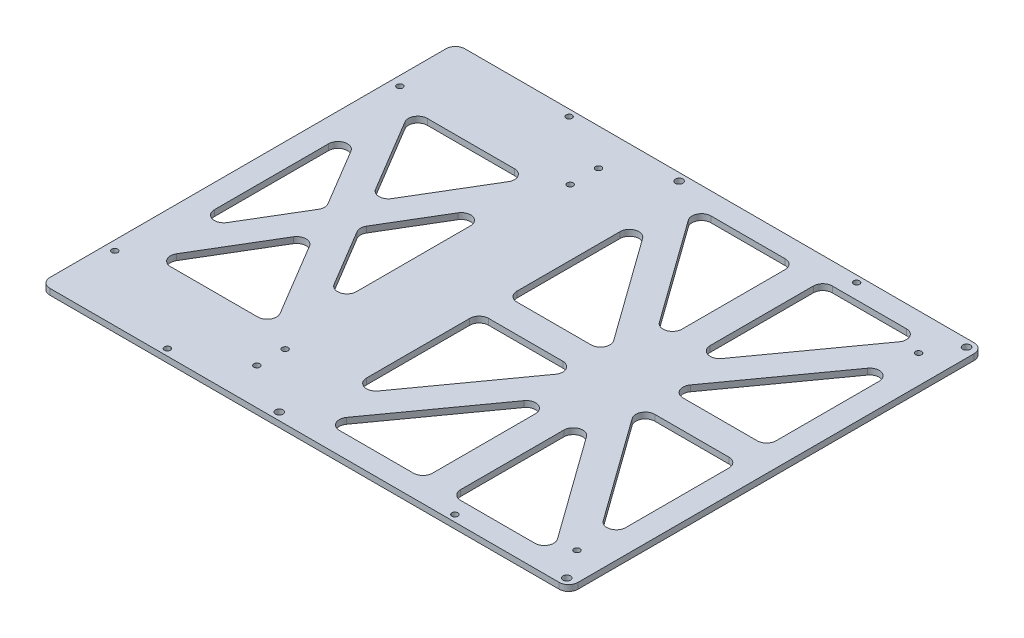
from build123d import *

# Parameters (mm, degrees)
SKETCH1_R                  = 3.175
BODY_DEPTH                 = 6.35
ELECTRONICS_BOX_REACH      = 358.146
SKETCH3_R                  = 4
BATTERY_CHARGER_REACH      = 358.146
SKETCH5_R                  = 3.175
FILLETS_REACH              = 358.146
PLANT_MOUNTING_HOLES_REACH = 358.146
SKETCH7_R                  = 3.175


with BuildPart() as part:
    # Sketch1 → Body (new body)
    with BuildSketch(Plane(origin=(0, 0, 0), x_dir=(1, 0, 0), z_dir=(0, 1, 0))):
        with BuildLine():
            Line((-280, -210), (-280, 210))
            ThreePointArc((-280, 210), (-277.071067812, 217.071067812), (-270, 220))
            Line((-270, 220), (270, 220))
            ThreePointArc((270, 220), (277.071067812, 217.071067812), (280, 210))
            Line((280, 210), (280, -210))
            ThreePointArc((280, -210), (277.071067812, -217.071067812), (270, -220))
            Line((270, -220), (-270, -220))
            ThreePointArc((-270, -220), (-277.071067812, -217.071067812), (-280, -210))
        make_face()
        with Locations(Location((-152.4, -213, 0), (0, 0, 270))):
            Circle(SKETCH1_R, mode=Mode.SUBTRACT)
        with Locations(Location((-152.4, 213, 0), (0, 0, 90))):
            Circle(SKETCH1_R, mode=Mode.SUBTRACT)
        with Locations(Location((152.4, 213, 0), (0, 0, 270))):
            Circle(SKETCH1_R, mode=Mode.SUBTRACT)
        with Locations(Location((152.4, -213, 0), (0, 0, 90))):
            Circle(SKETCH1_R, mode=Mode.SUBTRACT)
    extrude(amount=BODY_DEPTH)

    # Sketch3 → Electronics Box (cut, up to next)
    with BuildSketch(Plane(origin=(0, 6.35, 0), x_dir=(1, 0, 0), z_dir=(0, 1, 0)), mode=Mode.PRIVATE) as electronics_box_sk1:
        with Locations(Location((-34.8, -211.98, 0), (0, 0, 270))):
            Circle(SKETCH3_R)
    electronics_box_tool1 = extrude(electronics_box_sk1.sketch, amount=-ELECTRONICS_BOX_REACH, mode=Mode.PRIVATE) & part.part
    # Sketch3 → Electronics Box (cut, up to next)
    with BuildSketch(Plane(origin=(0, 6.35, 0), x_dir=(1, 0, 0), z_dir=(0, 1, 0)), mode=Mode.PRIVATE) as electronics_box_sk2:
        with Locations(Location((270, -211.98, 0), (0, 0, 270))):
            Circle(SKETCH3_R)
    electronics_box_tool2 = extrude(electronics_box_sk2.sketch, amount=-ELECTRONICS_BOX_REACH, mode=Mode.PRIVATE) & part.part
    # Sketch3 → Electronics Box (cut, up to next)
    with BuildSketch(Plane(origin=(0, 6.35, 0), x_dir=(1, 0, 0), z_dir=(0, 1, 0)), mode=Mode.PRIVATE) as electronics_box_sk3:
        with Locations(Location((270, 211.98, 0), (0, 0, 270))):
            Circle(SKETCH3_R)
    electronics_box_tool3 = extrude(electronics_box_sk3.sketch, amount=-ELECTRONICS_BOX_REACH, mode=Mode.PRIVATE) & part.part
    # Sketch3 → Electronics Box (cut, up to next)
    with BuildSketch(Plane(origin=(0, 6.35, 0), x_dir=(1, 0, 0), z_dir=(0, 1, 0)), mode=Mode.PRIVATE) as electronics_box_sk4:
        with Locations(Location((-34.8, 211.98, 0), (0, 0, 270))):
            Circle(SKETCH3_R)
    electronics_box_tool4 = extrude(electronics_box_sk4.sketch, amount=-ELECTRONICS_BOX_REACH, mode=Mode.PRIVATE) & part.part
    add(electronics_box_tool1.solids().sort_by_distance((-34.8, 6.35, 211.98))[0], mode=Mode.SUBTRACT)
    add(electronics_box_tool2.solids().sort_by_distance((270, 6.35, 211.98))[0], mode=Mode.SUBTRACT)
    add(electronics_box_tool3.solids().sort_by_distance((270, 6.35, -211.98))[0], mode=Mode.SUBTRACT)
    add(electronics_box_tool4.solids().sort_by_distance((-34.8, 6.35, -211.98))[0], mode=Mode.SUBTRACT)

    # Sketch5 → Battery Charger (cut, up to next)
    with BuildSketch(Plane(origin=(0, 6.35, 0), x_dir=(1, 0, 0), z_dir=(0, 1, 0)), mode=Mode.PRIVATE) as battery_charger_sk1:
        with Locations(Location((-270, -151.13, 0), (0, 0, 270))):
            Circle(SKETCH5_R)
    battery_charger_tool1 = extrude(battery_charger_sk1.sketch, amount=-BATTERY_CHARGER_REACH, mode=Mode.PRIVATE) & part.part
    # Sketch5 → Battery Charger (cut, up to next)
    with BuildSketch(Plane(origin=(0, 6.35, 0), x_dir=(1, 0, 0), z_dir=(0, 1, 0)), mode=Mode.PRIVATE) as battery_charger_sk2:
        with Locations(Location((-270, 151.13, 0), (0, 0, 270))):
            Circle(SKETCH5_R)
    battery_charger_tool2 = extrude(battery_charger_sk2.sketch, amount=-BATTERY_CHARGER_REACH, mode=Mode.PRIVATE) & part.part
    # Sketch5 → Battery Charger (cut, up to next)
    with BuildSketch(Plane(origin=(0, 6.35, 0), x_dir=(1, 0, 0), z_dir=(0, 1, 0)), mode=Mode.PRIVATE) as battery_charger_sk3:
        with Locations(Location((-89.43, -151.13, 0), (0, 0, 270))):
            Circle(SKETCH5_R)
    battery_charger_tool3 = extrude(battery_charger_sk3.sketch, amount=-BATTERY_CHARGER_REACH, mode=Mode.PRIVATE) & part.part
    # Sketch5 → Battery Charger (cut, up to next)
    with BuildSketch(Plane(origin=(0, 6.35, 0), x_dir=(1, 0, 0), z_dir=(0, 1, 0)), mode=Mode.PRIVATE) as battery_charger_sk4:
        with Locations(Location((-89.43, 151.13, 0), (0, 0, 270))):
            Circle(SKETCH5_R)
    battery_charger_tool4 = extrude(battery_charger_sk4.sketch, amount=-BATTERY_CHARGER_REACH, mode=Mode.PRIVATE) & part.part
    add(battery_charger_tool1.solids().sort_by_distance((-270, 6.35, 151.13))[0], mode=Mode.SUBTRACT)
    add(battery_charger_tool2.solids().sort_by_distance((-270, 6.35, -151.13))[0], mode=Mode.SUBTRACT)
    add(battery_charger_tool3.solids().sort_by_distance((-89.43, 6.35, 151.13))[0], mode=Mode.SUBTRACT)
    add(battery_charger_tool4.solids().sort_by_distance((-89.43, 6.35, -151.13))[0], mode=Mode.SUBTRACT)

    # Sketch6 → Fillets (cut, up to next)
    with BuildSketch(Plane(origin=(0, 6.35, 0), x_dir=(1, 0, 0), z_dir=(0, 1, 0)), mode=Mode.PRIVATE) as fillets_sk1:
        with BuildLine():
            Line((-255, 60.535084541), (-255, -60.535084541))
            ThreePointArc((-255, -60.535084541), (-247.660110592, -70.17478431), (-236.415237673, -65.663618033))
            Line((-236.415237673, -65.663618033), (-200.251603002, -5.128533492))
            ThreePointArc((-200.251603002, -5.128533492), (-198.836365329, 0), (-200.251603002, 5.128533492))
            Line((-200.251603002, 5.128533492), (-236.415237673, 65.663618033))
            ThreePointArc((-236.415237673, 65.663618033), (-247.660110592, 70.17478431), (-255, 60.535084541))
        make_face()
    fillets_tool1 = extrude(fillets_sk1.sketch, amount=-FILLETS_REACH, mode=Mode.PRIVATE) & part.part
    # Sketch6 → Fillets (cut, up to next)
    with BuildSketch(Plane(origin=(0, 6.35, 0), x_dir=(1, 0, 0), z_dir=(0, 1, 0)), mode=Mode.PRIVATE) as fillets_sk2:
        with BuildLine():
            Line((-159.178396998, 5.128533492), (-123.014762327, 65.663618033))
            ThreePointArc((-123.014762327, 65.663618033), (-111.769889408, 70.17478431), (-104.43, 60.535084541))
            Line((-104.43, 60.535084541), (-104.43, -60.535084541))
            ThreePointArc((-104.43, -60.535084541), (-111.769889408, -70.17478431), (-123.014762327, -65.663618033))
            Line((-123.014762327, -65.663618033), (-159.178396998, -5.128533492))
            ThreePointArc((-159.178396998, -5.128533492), (-160.593634671, 0), (-159.178396998, 5.128533492))
        make_face()
    fillets_tool2 = extrude(fillets_sk2.sketch, amount=-FILLETS_REACH, mode=Mode.PRIVATE) & part.part
    # Sketch6 → Fillets (cut, up to next)
    with BuildSketch(Plane(origin=(0, 6.35, 0), x_dir=(1, 0, 0), z_dir=(0, 1, 0)), mode=Mode.PRIVATE) as fillets_sk3:
        with BuildLine():
            Line((-234.528407254, -121.001466508), (-188.299762327, -43.618345194))
            ThreePointArc((-188.299762327, -43.618345194), (-179.715, -38.746878687), (-171.130237673, -43.618345194))
            Line((-171.130237673, -43.618345194), (-124.901592746, -121.001466508))
            ThreePointArc((-124.901592746, -121.001466508), (-124.78907576, -131.065314837), (-133.486355073, -136.13))
            Line((-133.486355073, -136.13), (-225.943644927, -136.13))
            ThreePointArc((-225.943644927, -136.13), (-234.64092424, -131.065314837), (-234.528407254, -121.001466508))
        make_face()
    fillets_tool3 = extrude(fillets_sk3.sketch, amount=-FILLETS_REACH, mode=Mode.PRIVATE) & part.part
    # Sketch6 → Fillets (cut, up to next)
    with BuildSketch(Plane(origin=(0, 6.35, 0), x_dir=(1, 0, 0), z_dir=(0, 1, 0)), mode=Mode.PRIVATE) as fillets_sk4:
        with BuildLine():
            Line((-171.130237673, 43.618345194), (-124.901592746, 121.001466508))
            ThreePointArc((-124.901592746, 121.001466508), (-124.78907576, 131.065314837), (-133.486355073, 136.13))
            Line((-133.486355073, 136.13), (-225.943644927, 136.13))
            ThreePointArc((-225.943644927, 136.13), (-234.64092424, 131.065314837), (-234.528407254, 121.001466508))
            Line((-234.528407254, 121.001466508), (-188.299762327, 43.618345194))
            ThreePointArc((-188.299762327, 43.618345194), (-179.715, 38.746878687), (-171.130237673, 43.618345194))
        make_face()
    fillets_tool4 = extrude(fillets_sk4.sketch, amount=-FILLETS_REACH, mode=Mode.PRIVATE) & part.part
    # Sketch6 → Fillets (cut, up to next)
    with BuildSketch(Plane(origin=(0, 6.35, 0), x_dir=(1, 0, 0), z_dir=(0, 1, 0)), mode=Mode.PRIVATE) as fillets_sk5:
        with BuildLine():
            Line((-1.680561104, 140.21611569), (76.955740185, 30.837354881))
            ThreePointArc((76.955740185, 30.837354881), (77.734996384, 20.437848578), (68.836301289, 15))
            Line((68.836301289, 15), (-9.8, 15))
            ThreePointArc((-9.8, 15), (-16.871067812, 17.928932188), (-19.8, 25))
            Line((-19.8, 25), (-19.8, 134.378760808))
            ThreePointArc((-19.8, 134.378760808), (-12.866399439, 143.897016661), (-1.680561104, 140.21611569))
        make_face()
    fillets_tool5 = extrude(fillets_sk5.sketch, amount=-FILLETS_REACH, mode=Mode.PRIVATE) & part.part
    # Sketch6 → Fillets (cut, up to next)
    with BuildSketch(Plane(origin=(0, 6.35, 0), x_dir=(1, 0, 0), z_dir=(0, 1, 0)), mode=Mode.PRIVATE) as fillets_sk6:
        with BuildLine():
            Line((255, 25), (255, 134.378760808))
            ThreePointArc((255, 134.378760808), (248.066399439, 143.897016661), (236.880561104, 140.21611569))
            Line((236.880561104, 140.21611569), (158.244259815, 30.837354881))
            ThreePointArc((158.244259815, 30.837354881), (157.465003616, 20.437848578), (166.363698711, 15))
            Line((166.363698711, 15), (245, 15))
            ThreePointArc((245, 15), (252.071067812, 17.928932188), (255, 25))
        make_face()
    fillets_tool6 = extrude(fillets_sk6.sketch, amount=-FILLETS_REACH, mode=Mode.PRIVATE) & part.part
    # Sketch6 → Fillets (cut, up to next)
    with BuildSketch(Plane(origin=(0, 6.35, 0), x_dir=(1, 0, 0), z_dir=(0, 1, 0)), mode=Mode.PRIVATE) as fillets_sk7:
        with BuildLine():
            Line((84.480561104, 71.76388431), (5.844259815, 181.142645119))
            ThreePointArc((5.844259815, 181.142645119), (5.065003616, 191.542151422), (13.963698711, 196.98))
            Line((13.963698711, 196.98), (92.6, 196.98))
            ThreePointArc((92.6, 196.98), (99.671067812, 194.051067812), (102.6, 186.98))
            Line((102.6, 186.98), (102.6, 77.601239192))
            ThreePointArc((102.6, 77.601239192), (95.666399439, 68.082983339), (84.480561104, 71.76388431))
        make_face()
    fillets_tool7 = extrude(fillets_sk7.sketch, amount=-FILLETS_REACH, mode=Mode.PRIVATE) & part.part
    # Sketch6 → Fillets (cut, up to next)
    with BuildSketch(Plane(origin=(0, 6.35, 0), x_dir=(1, 0, 0), z_dir=(0, 1, 0)), mode=Mode.PRIVATE) as fillets_sk8:
        with BuildLine():
            Line((221.236301289, 196.98), (142.6, 196.98))
            ThreePointArc((142.6, 196.98), (135.528932188, 194.051067812), (132.6, 186.98))
            Line((132.6, 186.98), (132.6, 77.601239192))
            ThreePointArc((132.6, 77.601239192), (139.533600561, 68.082983339), (150.719438896, 71.76388431))
            Line((150.719438896, 71.76388431), (229.355740185, 181.142645119))
            ThreePointArc((229.355740185, 181.142645119), (230.134996384, 191.542151422), (221.236301289, 196.98))
        make_face()
    fillets_tool8 = extrude(fillets_sk8.sketch, amount=-FILLETS_REACH, mode=Mode.PRIVATE) & part.part
    # Sketch6 → Fillets (cut, up to next)
    with BuildSketch(Plane(origin=(0, 6.35, 0), x_dir=(1, 0, 0), z_dir=(0, 1, 0)), mode=Mode.PRIVATE) as fillets_sk9:
        with BuildLine():
            Line((102.6, -77.601239192), (102.6, -186.98))
            ThreePointArc((102.6, -186.98), (99.671067812, -194.051067812), (92.6, -196.98))
            Line((92.6, -196.98), (13.963698711, -196.98))
            ThreePointArc((13.963698711, -196.98), (5.065003616, -191.542151422), (5.844259815, -181.142645119))
            Line((5.844259815, -181.142645119), (84.480561104, -71.76388431))
            ThreePointArc((84.480561104, -71.76388431), (95.666399439, -68.082983339), (102.6, -77.601239192))
        make_face()
    fillets_tool9 = extrude(fillets_sk9.sketch, amount=-FILLETS_REACH, mode=Mode.PRIVATE) & part.part
    # Sketch6 → Fillets (cut, up to next)
    with BuildSketch(Plane(origin=(0, 6.35, 0), x_dir=(1, 0, 0), z_dir=(0, 1, 0)), mode=Mode.PRIVATE) as fillets_sk10:
        with BuildLine():
            Line((150.719438896, -71.76388431), (229.355740185, -181.142645119))
            ThreePointArc((229.355740185, -181.142645119), (230.134996384, -191.542151422), (221.236301289, -196.98))
            Line((221.236301289, -196.98), (142.6, -196.98))
            ThreePointArc((142.6, -196.98), (135.528932188, -194.051067812), (132.6, -186.98))
            Line((132.6, -186.98), (132.6, -77.601239192))
            ThreePointArc((132.6, -77.601239192), (139.533600561, -68.082983339), (150.719438896, -71.76388431))
        make_face()
    fillets_tool10 = extrude(fillets_sk10.sketch, amount=-FILLETS_REACH, mode=Mode.PRIVATE) & part.part
    # Sketch6 → Fillets (cut, up to next)
    with BuildSketch(Plane(origin=(0, 6.35, 0), x_dir=(1, 0, 0), z_dir=(0, 1, 0)), mode=Mode.PRIVATE) as fillets_sk11:
        with BuildLine():
            Line((236.880561104, -140.21611569), (158.244259815, -30.837354881))
            ThreePointArc((158.244259815, -30.837354881), (157.465003616, -20.437848578), (166.363698711, -15))
            Line((166.363698711, -15), (245, -15))
            ThreePointArc((245, -15), (252.071067812, -17.928932188), (255, -25))
            Line((255, -25), (255, -134.378760808))
            ThreePointArc((255, -134.378760808), (248.066399439, -143.897016661), (236.880561104, -140.21611569))
        make_face()
    fillets_tool11 = extrude(fillets_sk11.sketch, amount=-FILLETS_REACH, mode=Mode.PRIVATE) & part.part
    # Sketch6 → Fillets (cut, up to next)
    with BuildSketch(Plane(origin=(0, 6.35, 0), x_dir=(1, 0, 0), z_dir=(0, 1, 0)), mode=Mode.PRIVATE) as fillets_sk12:
        with BuildLine():
            Line((-19.8, -25), (-19.8, -134.378760808))
            ThreePointArc((-19.8, -134.378760808), (-12.866399439, -143.897016661), (-1.680561104, -140.21611569))
            Line((-1.680561104, -140.21611569), (76.955740185, -30.837354881))
            ThreePointArc((76.955740185, -30.837354881), (77.734996384, -20.437848578), (68.836301289, -15))
            Line((68.836301289, -15), (-9.8, -15))
            ThreePointArc((-9.8, -15), (-16.871067812, -17.928932188), (-19.8, -25))
        make_face()
    fillets_tool12 = extrude(fillets_sk12.sketch, amount=-FILLETS_REACH, mode=Mode.PRIVATE) & part.part
    add(fillets_tool1.solids().sort_by_distance((-234.493731, 6.35, 0))[0], mode=Mode.SUBTRACT)
    add(fillets_tool2.solids().sort_by_distance((-124.936269, 6.35, 0))[0], mode=Mode.SUBTRACT)
    add(fillets_tool3.solids().sort_by_distance((-179.715, 6.35, 100.443358))[0], mode=Mode.SUBTRACT)
    add(fillets_tool4.solids().sort_by_distance((-179.715, 6.35, -100.443358))[0], mode=Mode.SUBTRACT)
    add(fillets_tool5.solids().sort_by_distance((16.371701, 6.35, -63.773404))[0], mode=Mode.SUBTRACT)
    add(fillets_tool6.solids().sort_by_distance((218.828299, 6.35, -63.773404))[0], mode=Mode.SUBTRACT)
    add(fillets_tool7.solids().sort_by_distance((66.428299, 6.35, -148.206596))[0], mode=Mode.SUBTRACT)
    add(fillets_tool8.solids().sort_by_distance((168.771701, 6.35, -148.206596))[0], mode=Mode.SUBTRACT)
    add(fillets_tool9.solids().sort_by_distance((66.428299, 6.35, 148.206596))[0], mode=Mode.SUBTRACT)
    add(fillets_tool10.solids().sort_by_distance((168.771701, 6.35, 148.206596))[0], mode=Mode.SUBTRACT)
    add(fillets_tool11.solids().sort_by_distance((218.828299, 6.35, 63.773404))[0], mode=Mode.SUBTRACT)
    add(fillets_tool12.solids().sort_by_distance((16.371701, 6.35, 63.773404))[0], mode=Mode.SUBTRACT)

    # Sketch7 → Plant Mounting holes (cut, up to next)
    with BuildSketch(Plane(origin=(0, 6.35, 0), x_dir=(1, 0, 0), z_dir=(0, 1, 0)), mode=Mode.PRIVATE) as plant_mounting_holes_sk1:
        with Locations(Location((250, 181.13, 0), (0, 0, 270))):
            Circle(SKETCH7_R)
    plant_mounting_holes_tool1 = extrude(plant_mounting_holes_sk1.sketch, amount=-PLANT_MOUNTING_HOLES_REACH, mode=Mode.PRIVATE) & part.part
    # Sketch7 → Plant Mounting holes (cut, up to next)
    with BuildSketch(Plane(origin=(0, 6.35, 0), x_dir=(1, 0, 0), z_dir=(0, 1, 0)), mode=Mode.PRIVATE) as plant_mounting_holes_sk2:
        with Locations(Location((-89.43, 181.13, 0), (0, 0, 270))):
            Circle(SKETCH7_R)
    plant_mounting_holes_tool2 = extrude(plant_mounting_holes_sk2.sketch, amount=-PLANT_MOUNTING_HOLES_REACH, mode=Mode.PRIVATE) & part.part
    # Sketch7 → Plant Mounting holes (cut, up to next)
    with BuildSketch(Plane(origin=(0, 6.35, 0), x_dir=(1, 0, 0), z_dir=(0, 1, 0)), mode=Mode.PRIVATE) as plant_mounting_holes_sk3:
        with Locations(Location((-89.43, -181.13, 0), (0, 0, 90))):
            Circle(SKETCH7_R)
    plant_mounting_holes_tool3 = extrude(plant_mounting_holes_sk3.sketch, amount=-PLANT_MOUNTING_HOLES_REACH, mode=Mode.PRIVATE) & part.part
    # Sketch7 → Plant Mounting holes (cut, up to next)
    with BuildSketch(Plane(origin=(0, 6.35, 0), x_dir=(1, 0, 0), z_dir=(0, 1, 0)), mode=Mode.PRIVATE) as plant_mounting_holes_sk4:
        with Locations(Location((250, -181.13, 0), (0, 0, 90))):
            Circle(SKETCH7_R)
    plant_mounting_holes_tool4 = extrude(plant_mounting_holes_sk4.sketch, amount=-PLANT_MOUNTING_HOLES_REACH, mode=Mode.PRIVATE) & part.part
    add(plant_mounting_holes_tool1.solids().sort_by_distance((250, 6.35, -181.13))[0], mode=Mode.SUBTRACT)
    add(plant_mounting_holes_tool2.solids().sort_by_distance((-89.43, 6.35, -181.13))[0], mode=Mode.SUBTRACT)
    add(plant_mounting_holes_tool3.solids().sort_by_distance((-89.43, 6.35, 181.13))[0], mode=Mode.SUBTRACT)
    add(plant_mounting_holes_tool4.solids().sort_by_distance((250, 6.35, 181.13))[0], mode=Mode.SUBTRACT)


solid = part.part
